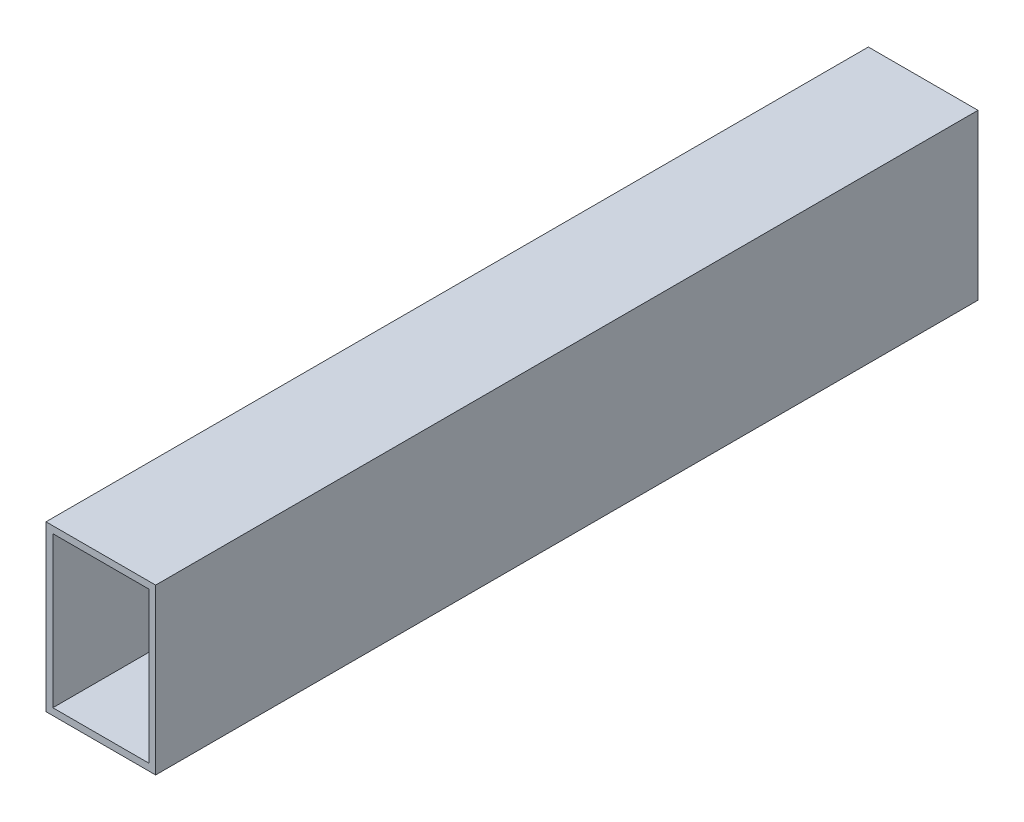
from build123d import *

# Parameters (mm, degrees)
SKETCH1_W           = 50.8
SKETCH1_H           = 76.2
SKETCH1_W_2         = 44.45
SKETCH1_H_2         = 69.85
BOSS_EXTRUDE1_DEPTH = 381


with BuildPart() as part:
    # Sketch1 → Boss-Extrude1 (new body)
    with BuildSketch(Plane.XY):
        Rectangle(SKETCH1_W, SKETCH1_H)
        Rectangle(SKETCH1_W_2, SKETCH1_H_2, mode=Mode.SUBTRACT)
    extrude(amount=BOSS_EXTRUDE1_DEPTH)


solid = part.part
